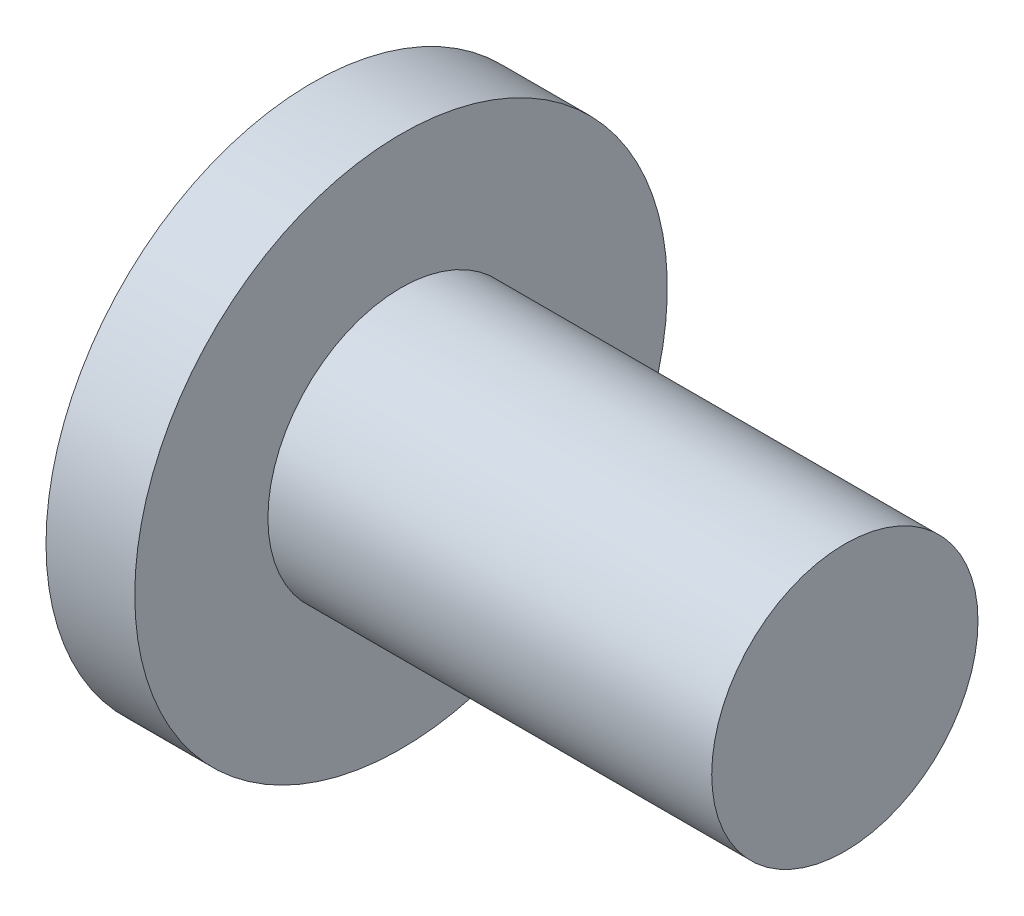
from build123d import *


with BuildPart() as part:
    # Sketch1 → Revolve1 (revolve)
    with BuildSketch(Plane.XY, mode=Mode.PRIVATE) as revolve1_sk:
        Polygon((-6, 0), (-6, 6), (-4, 6), (-4, 3), (6, 3), (6, 0), align=None)
    revolve(revolve1_sk.sketch.rotate(Axis((-10.619469027, 0, 0), (1, 0, 0)), 90), axis=Axis((-10.619469027, 0, 0), (1, 0, 0)))


solid = part.part
